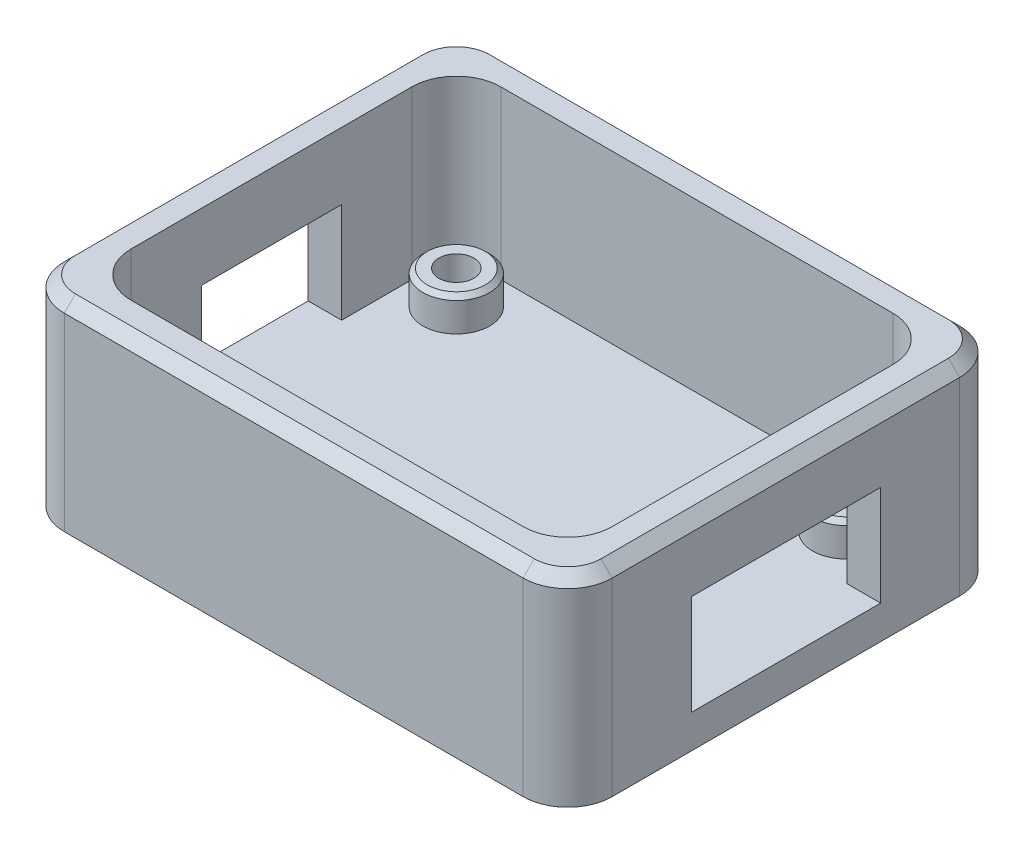
from build123d import *

# Parameters (mm, degrees)
SKETCH1_W                    = 62.484
SKETCH1_H                    = 49.784
SKETCH1_W_2                  = 54.864
SKETCH1_H_2                  = 42.164
BOSS_EXTRUDE1_DEPTH          = 19.05
SKETCH3_W                    = 62.484
SKETCH3_H                    = 49.784
BOSS_EXTRUDE2_DEPTH          = 3.81
FILLET1_R                    = 5.08
SKETCH4_R                    = 3.81
BOSS_EXTRUDE3_DEPTH          = 3.81
F_4_0_4_DIAMETER_HOLE1_D     = 4
F_4_0_4_DIAMETER_HOLE1_DEPTH = 6.35
F_4_0_4_DIAMETER_HOLE1_TIP   = 1.201721238
CUT_EXTRUDE1_REACH           = 81.88
SKETCH8_W                    = 21.59
SKETCH8_H                    = 11.43
CUT_EXTRUDE2_REACH           = 81.88
SKETCH9_W                    = 16.002
SKETCH9_H                    = 11.43
FILLET2_R                    = 5.08
CHAMFER1_SIZE                = 1.27
CHAMFER2_SIZE                = 0.508


with BuildPart() as part:
    # Sketch1 → Boss-Extrude1 (new body)
    with BuildSketch(Plane(origin=(0, 0, 0), x_dir=(1, 0, 0), z_dir=(0, 1, 0))):
        with Locations((27.432, -21.082)):
            Rectangle(SKETCH1_W, SKETCH1_H)
        with Locations((27.432, -21.082)):
            Rectangle(SKETCH1_W_2, SKETCH1_H_2, mode=Mode.SUBTRACT)
    extrude(amount=BOSS_EXTRUDE1_DEPTH)

    # Sketch3 → Boss-Extrude2 (add)
    with BuildSketch(Plane.XZ):
        with Locations((27.432, 21.082)):
            Rectangle(SKETCH3_W, SKETCH3_H)
    extrude(amount=BOSS_EXTRUDE2_DEPTH)

    # Fillet1
    fillet1_edges = [part.edges().sort_by_distance(p)[0] for p in [
        (0, 9.525, 0),
        (0, 9.525, 42.164),
        (54.864, 9.525, 42.164),
        (54.864, 9.525, 0),
    ]]
    fillet(fillet1_edges, radius=FILLET1_R)

    # Sketch4 → Boss-Extrude3 (add)
    with BuildSketch(Plane(origin=(0, 0, 0), x_dir=(1, 0, 0), z_dir=(0, 1, 0))):
        with Locations(Location((49.657, -5.207, 0), (0, 0, 90))):
            Circle(SKETCH4_R)
        with Locations(Location((49.657, -36.957, 0), (0, 0, 90))):
            Circle(SKETCH4_R)
        with Locations(Location((5.207, -36.957, 0), (0, 0, 90))):
            Circle(SKETCH4_R)
        with Locations(Location((5.207, -5.207, 0), (0, 0, 90))):
            Circle(SKETCH4_R)
    extrude(amount=BOSS_EXTRUDE3_DEPTH)

    # Ø4.0 (4) Diameter Hole1
    with Locations(Plane(origin=(5.207, 3.81, 5.207), x_dir=(0, 0, 1), z_dir=(0, 1, 0))):
        with Locations((0, 0), (31.75, 0), (31.75, 44.45), (0, 44.45)):
            Hole(F_4_0_4_DIAMETER_HOLE1_D / 2, depth=F_4_0_4_DIAMETER_HOLE1_DEPTH)
            with Locations((0, 0, -(F_4_0_4_DIAMETER_HOLE1_DEPTH + F_4_0_4_DIAMETER_HOLE1_TIP / 2))):  # 118° drill point
                Cone(0, F_4_0_4_DIAMETER_HOLE1_D / 2, F_4_0_4_DIAMETER_HOLE1_TIP, mode=Mode.SUBTRACT)

    # Sketch8 → Cut-Extrude1 (cut, up to next)
    with BuildSketch(Plane(origin=(58.674, 0, 0), x_dir=(0, 0, -1), z_dir=(1, 0, 0)), mode=Mode.PRIVATE) as cut_extrude1_sk1:
        with Locations((-21.082, 5.715)):
            Rectangle(SKETCH8_W, SKETCH8_H)
    cut_extrude1_tool1 = extrude(cut_extrude1_sk1.sketch, amount=-CUT_EXTRUDE1_REACH, mode=Mode.PRIVATE) & part.part
    add(cut_extrude1_tool1.solids().sort_by_distance((58.674, 5.715, 21.082))[0], mode=Mode.SUBTRACT)

    # Sketch9 → Cut-Extrude2 (cut, up to next)
    with BuildSketch(Plane.ZY.offset(3.81), mode=Mode.PRIVATE) as cut_extrude2_sk1:
        with Locations((21.082, 5.715)):
            Rectangle(SKETCH9_W, SKETCH9_H)
    cut_extrude2_tool1 = extrude(cut_extrude2_sk1.sketch, amount=-CUT_EXTRUDE2_REACH, mode=Mode.PRIVATE) & part.part
    add(cut_extrude2_tool1.solids().sort_by_distance((-3.81, 5.715, 21.082))[0], mode=Mode.SUBTRACT)

    # Fillet2
    fillet2_edges = [part.edges().sort_by_distance(p)[0] for p in [
        (-3.81, 7.62, -3.81),
        (58.674, 7.62, -3.81),
        (58.674, 7.62, 45.974),
        (-3.81, 7.62, 45.974),
    ]]
    fillet(fillet2_edges, radius=FILLET2_R)

    # Chamfer1
    chamfer1_edges = [part.edges().sort_by_distance(p)[0] for p in [
        (-3.81, 19.05, 21.082),
        (27.432, 19.05, -3.81),
        (27.432, 19.05, 45.974),
        (58.674, 19.05, 21.082),
        (-2.322102448, 19.05, 44.486102448),
        (57.186102448, 19.05, 44.486102448),
        (57.186102448, 19.05, -2.322102448),
        (-2.322102448, 19.05, -2.322102448),
    ]]
    chamfer(chamfer1_edges, length=CHAMFER1_SIZE)

    # Chamfer2
    chamfer2_edges = [part.edges().sort_by_distance(p)[0] for p in [
        (49.657, 3.81, 9.017),
        (49.657, 3.81, 40.767),
        (5.207, 3.81, 40.767),
        (5.207, 3.81, 9.017),
    ]]
    chamfer(chamfer2_edges, length=CHAMFER2_SIZE)


solid = part.part
